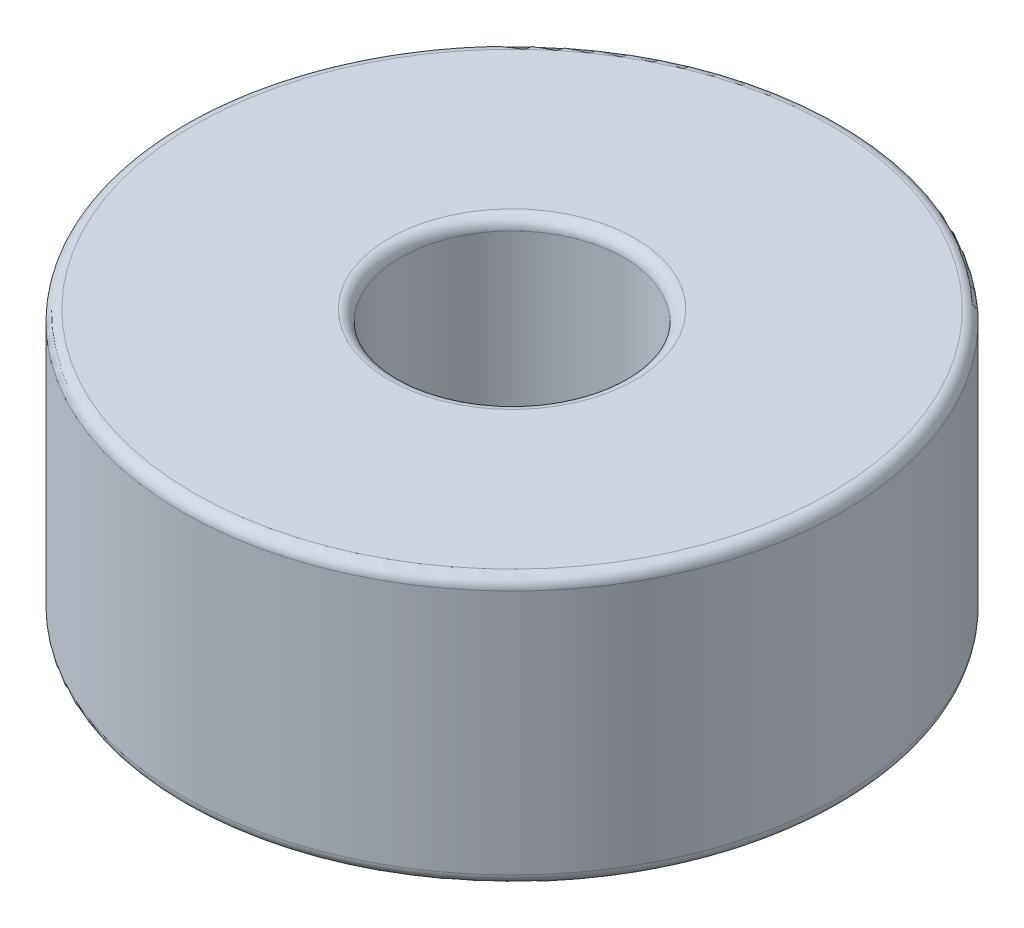
from build123d import *

# Parameters (mm, degrees)
SKETCH1_R           = 2.95
BOSS_EXTRUDE1_DEPTH = 2.4
SKETCH2_R           = 1
CUT_EXTRUDE1_DEPTH  = 5.81300322
FILLET1_R           = 0.1


with BuildPart() as part:
    # Sketch1 → Boss-Extrude1 (new body)
    with BuildSketch(Plane(origin=(0, 0, 0), x_dir=(1, 0, 0), z_dir=(0, 1, 0))):
        with Locations(Location((0, 0, 0), (0, 0, 270))):
            Circle(SKETCH1_R)
    extrude(amount=BOSS_EXTRUDE1_DEPTH)

    # Sketch2 → Cut-Extrude1 (cut, through all)
    with BuildSketch(Plane(origin=(0, 2.4, 0), x_dir=(1, 0, 0), z_dir=(0, 1, 0))):
        with Locations(Location((0, 0, 0), (0, 0, 270))):
            Circle(SKETCH2_R)
    extrude(amount=-CUT_EXTRUDE1_DEPTH, mode=Mode.SUBTRACT)

    # Fillet1
    fillet1_edges = [part.edges().sort_by_distance(p)[0] for p in [
        (0, 0, -2.95),
        (0, 2.4, -2.95),
        (0, 0, -1),
        (0, 2.4, -1),
    ]]
    fillet(fillet1_edges, radius=FILLET1_R)


solid = part.part
